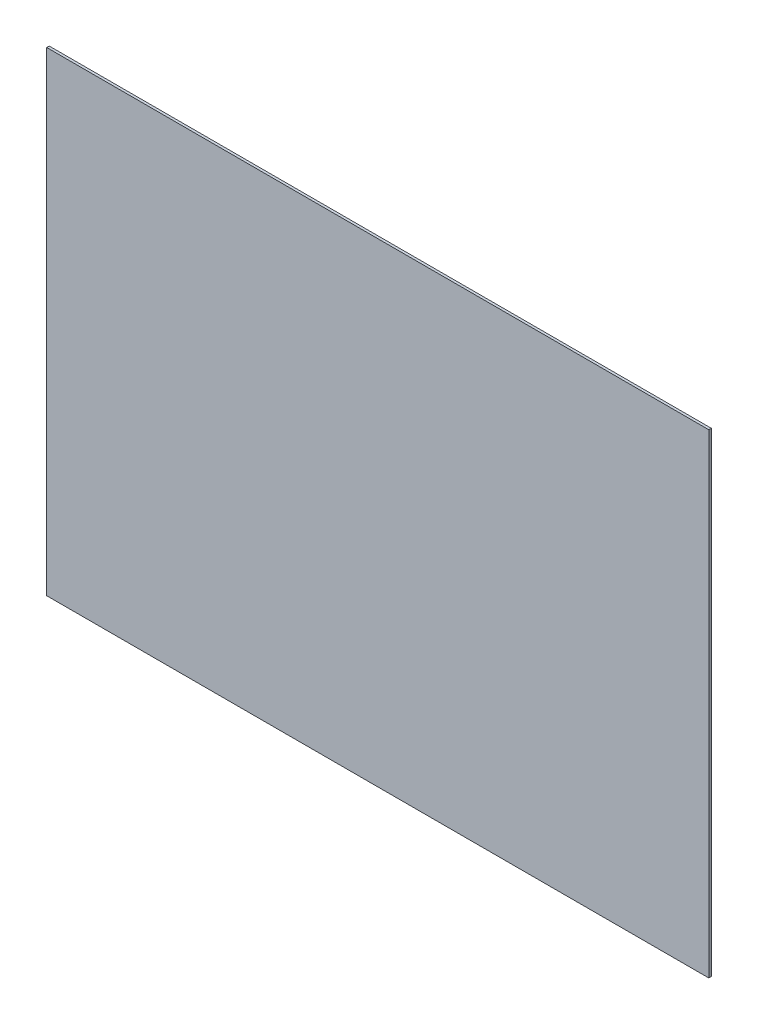
from build123d import *

# Parameters (mm, degrees)
CROQUIS1_W              = 1251.43
CROQUIS1_H              = 897.425
SALIENTE_EXTRUIR1_DEPTH = 4.7625


with BuildPart() as part:
    # Croquis1 → Saliente-Extruir1 (new body)
    with BuildSketch(Plane.XY):
        Rectangle(CROQUIS1_W, CROQUIS1_H)
    extrude(amount=SALIENTE_EXTRUIR1_DEPTH)


solid = part.part
